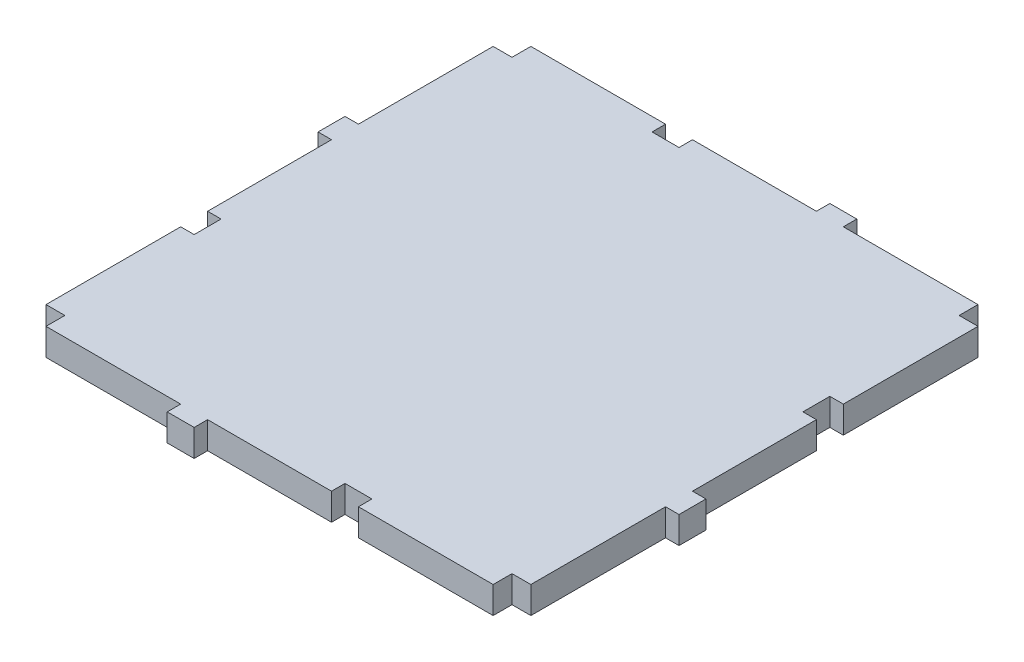
from build123d import *

# Parameters (mm, degrees)
SKETCH2_W           = 180
SKETCH2_H           = 180
BOSS_EXTRUDE1_DEPTH = 10
SKETCH9_W           = 14
SKETCH9_H           = 14
CUT_EXTRUDE2_DEPTH  = 10
SKETCH10_W          = 10
SKETCH10_H          = 10
BOSS_EXTRUDE2_DEPTH = 10
SKETCH11_W          = 10
SKETCH11_H          = 10
CUT_EXTRUDE3_DEPTH  = 10


with BuildPart() as part:
    # Sketch2 → Boss-Extrude1 (new body)
    with BuildSketch(Plane(origin=(0, 0, 0), x_dir=(1, 0, 0), z_dir=(0, 1, 0))):
        with Locations((-90, 90)):
            Rectangle(SKETCH2_W, SKETCH2_H)
    extrude(amount=BOSS_EXTRUDE1_DEPTH)

    # Sketch9 → Cut-Extrude2 (cut)
    with BuildSketch(Plane(origin=(0, 10, 0), x_dir=(1, 0, 0), z_dir=(0, 1, 0))):
        Rectangle(SKETCH9_W, SKETCH9_H)
        with Locations((-180, 0)):
            Rectangle(SKETCH9_W, SKETCH9_H)
        with Locations((-180, 180)):
            Rectangle(SKETCH9_W, SKETCH9_H)
        with Locations((0, 180)):
            Rectangle(SKETCH9_W, SKETCH9_H)
    extrude(amount=-CUT_EXTRUDE2_DEPTH, mode=Mode.SUBTRACT)

    # Sketch10 → Boss-Extrude2 (add)
    with BuildSketch(Plane(origin=(0, 10, 0), x_dir=(1, 0, 0), z_dir=(0, 1, 0))):
        with Locations((-180, 118)):
            Rectangle(SKETCH10_W, SKETCH10_H)
        with Locations((0, 62)):
            Rectangle(SKETCH10_W, SKETCH10_H)
        with Locations((-118, 0)):
            Rectangle(SKETCH10_W, SKETCH10_H)
        with Locations((-62, 180)):
            Rectangle(SKETCH10_W, SKETCH10_H)
    extrude(amount=-BOSS_EXTRUDE2_DEPTH)

    # Sketch11 → Cut-Extrude3 (cut)
    with BuildSketch(Plane(origin=(0, 10, 10), x_dir=(1, 0, 0), z_dir=(0, 1, 0))):
        with Locations((-180, 72)):
            Rectangle(SKETCH11_W, SKETCH11_H)
        with Locations((-62, 10)):
            Rectangle(SKETCH11_W, SKETCH11_H)
        with Locations((-118, 190)):
            Rectangle(SKETCH11_W, SKETCH11_H)
        with Locations((0, 128)):
            Rectangle(SKETCH11_W, SKETCH11_H)
    extrude(amount=-CUT_EXTRUDE3_DEPTH, mode=Mode.SUBTRACT)


solid = part.part
